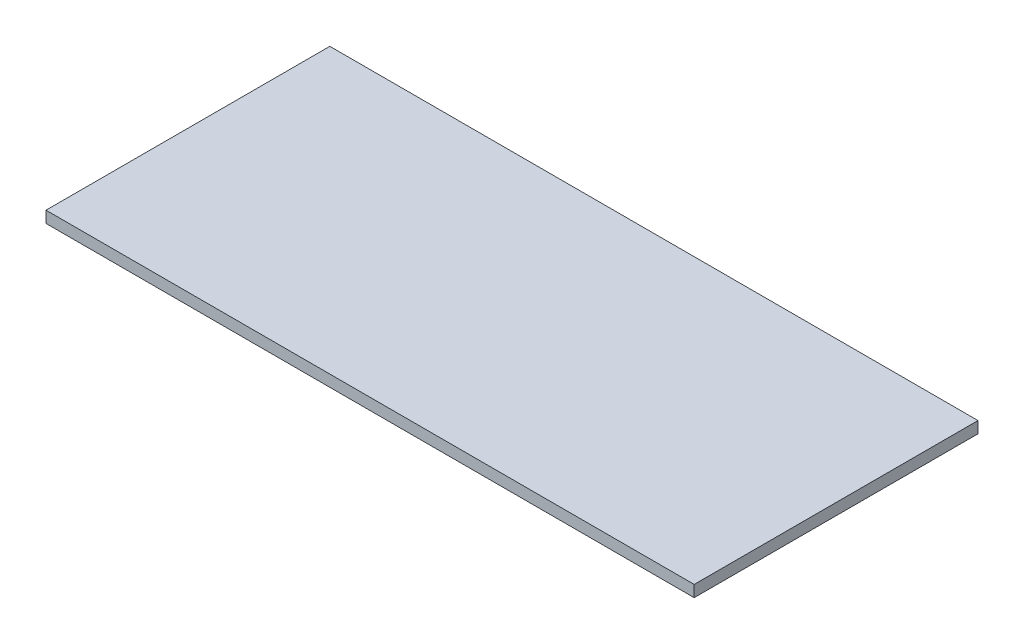
from build123d import *

# Parameters (mm, degrees)
SKETCH_1_W      = 84.5
SKETCH_1_H      = 37
EXTRUDE_1_DEPTH = 1.5


with BuildPart() as part:
    # Эскиз1 → Бобышка-Вытянуть1 (new body)
    with BuildSketch(Plane(origin=(0, 0, 0), x_dir=(1, 0, 0), z_dir=(0, 1, 0))):
        with Locations((42.25, -18.5)):
            Rectangle(SKETCH_1_W, SKETCH_1_H)
    extrude(amount=EXTRUDE_1_DEPTH)


solid = part.part
